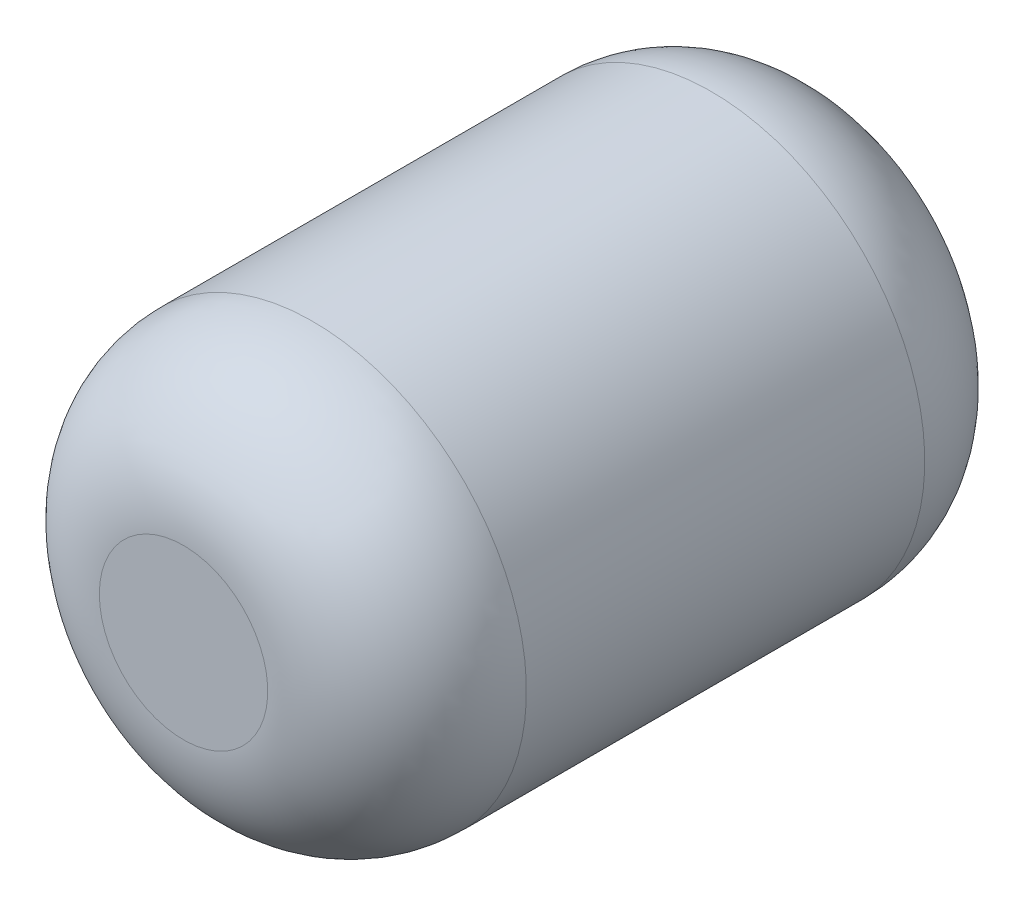
from build123d import *


with BuildPart() as part:
    # Sketch1 → Revolve1 (revolve)
    with BuildSketch(Plane(origin=(0, 0, 0), x_dir=(0, 0, -1), z_dir=(1, 0, 0)), mode=Mode.PRIVATE) as revolve1_sk:
        with BuildLine():
            Line((-77, 82.55), (77, 82.55))
            ThreePointArc((77, 82.55), (112.355339059, 67.905339059), (127, 32.55))
            Line((127, 32.55), (127, 0))
            Line((127, 0), (122, 0))
            Line((122, 0), (122, 32.55))
            ThreePointArc((122, 32.55), (108.819805153, 64.369805153), (77, 77.55))
            Line((77, 77.55), (-77, 77.55))
            ThreePointArc((-77, 77.55), (-108.819805153, 64.369805153), (-122, 32.55))
            Line((-122, 32.55), (-122, 0))
            Line((-122, 0), (-127, 0))
            Line((-127, 0), (-127, 32.55))
            ThreePointArc((-127, 32.55), (-112.355339059, 67.905339059), (-77, 82.55))
        make_face()
    revolve(revolve1_sk.sketch.rotate(Axis((0, 0, -193.425688195), (0, 0, 1)), 90), axis=Axis((0, 0, -193.425688195), (0, 0, 1)))


solid = part.part
